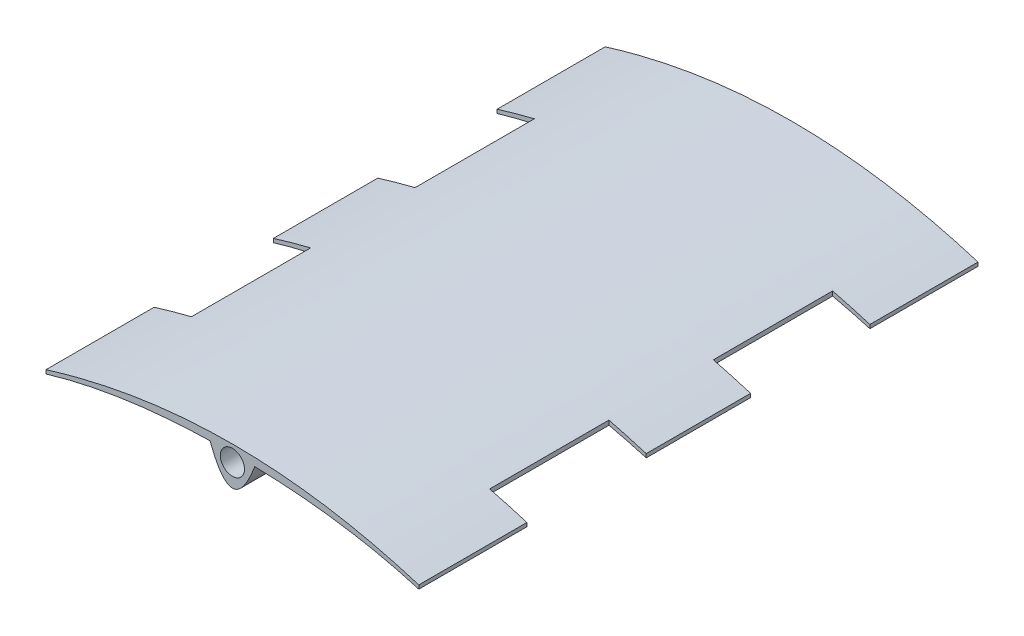
from build123d import *

# Parameters (mm, degrees)
SKETCH_1_R               = 3.25
EXTRUDE_1_DEPTH          = 150
CUT_EXTRUDE_1_DEPTH      = 159.227684181
CUT_EXTRUDE_1_DEPTH_BACK = 159.227684181
SKETCH_2_W               = 10
SKETCH_2_H               = 32


with BuildPart() as part:
    # 草圖1 → 填料-伸長1 (new body)
    with BuildSketch(Plane.XY):
        with BuildLine():
            Line((-50, -3.480646824), (-50, -4.480646824))
            add(Edge.make_bspline(
                [(-6, 2), (-30, 1.47316016), (-50, -4.480646824)],
                knots=[0, 0, 0, 1, 1, 1], degree=2))
            add(Edge.make_bspline(
                [(-6, 2), (0, -14), (6, 2)],
                knots=[0, 0, 0, 1, 1, 1], degree=2))
            add(Edge.make_bspline(
                [(6, 2), (30, 1.47316016), (50, -4.480646824)],
                knots=[0, 0, 0, 1, 1, 1], degree=2))
            Line((50, -4.480646824), (50, -3.480646824))
            add(Edge.make_bspline(
                [(-50, -3.480646824), (0, 12), (50, -3.480646824)],
                knots=[0, 0, 0, 1, 1, 1], degree=2))
        make_face()
        Circle(SKETCH_1_R, mode=Mode.SUBTRACT)
    extrude(amount=EXTRUDE_1_DEPTH)

    # 草圖2 → 除料-伸長1 (cut, two sides: drawn at the far end of the back side and taken through both)
    with BuildSketch(Plane(origin=(0, 0, 0), x_dir=(1, 0, 0), z_dir=(0, 1, 0)).offset(-CUT_EXTRUDE_1_DEPTH_BACK)):
        with Locations((-45, -105)):
            Rectangle(SKETCH_2_W, SKETCH_2_H)
        with Locations((-45, -45)):
            Rectangle(SKETCH_2_W, SKETCH_2_H)
        with Locations((45, -45)):
            Rectangle(SKETCH_2_W, SKETCH_2_H)
        with Locations((45, -105)):
            Rectangle(SKETCH_2_W, SKETCH_2_H)
    extrude(amount=CUT_EXTRUDE_1_DEPTH + CUT_EXTRUDE_1_DEPTH_BACK, mode=Mode.SUBTRACT)


solid = part.part
